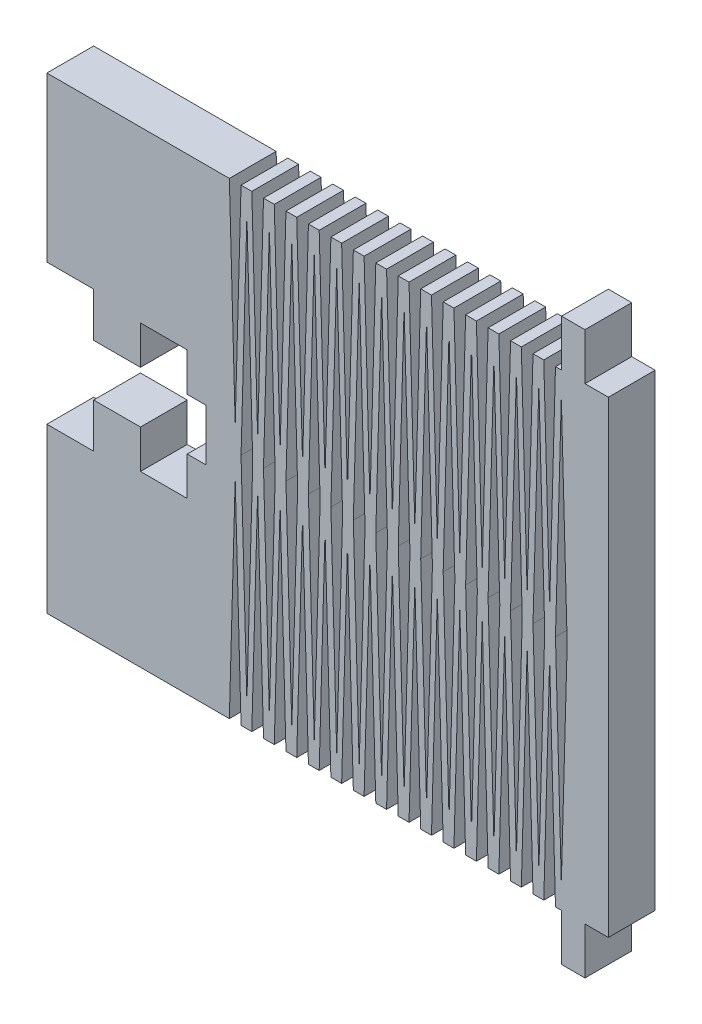
from build123d import *

# Parameters (mm, degrees)
BOSS_EXTRUDE2_DEPTH = 3.175


with BuildPart() as part:
    # Sketch1 → Boss-Extrude2 (new body)
    with BuildSketch(Plane.XY):
        Polygon((3.175, 20.6375), (3.175, 17.6276), (6.35, 17.6276), (6.35, 20.240625), (9.525, 20.240625), (9.525, 17.6276), (10.795, 17.6276), (10.795, 14.1224), (9.525, 14.1224), (9.525, 11.509375), (6.35, 11.509375), (6.35, 14.1224), (3.175, 14.1224), (3.175, 11.1125), (0, 11.1125), (0, 0), (12.3825, 0), (12.779375, 14.2875), (13.17625, 0), (13.9065, 0), (14.303375, 14.2875), (14.70025, 0), (15.4305, 0), (15.827375, 14.2875), (16.22425, 0), (16.9545, 0), (17.351375, 14.2875), (17.74825, 0), (18.4785, 0), (18.875375, 14.2875), (19.27225, 0), (20.0025, 0), (20.399375, 14.2875), (20.79625, 0), (21.5265, 0), (21.923375, 14.2875), (22.32025, 0), (23.0505, 0), (23.447375, 14.2875), (23.84425, 0), (24.5745, 0), (24.971375, 14.2875), (25.36825, 0), (26.0985, 0), (26.495375, 14.2875), (26.89225, 0), (27.6225, 0), (28.019375, 14.2875), (28.41625, 0), (29.1465, 0), (29.543375, 14.2875), (29.94025, 0), (30.6705, 0), (31.067375, 14.2875), (31.46425, 0), (32.1945, 0), (32.591375, 14.2875), (32.98825, 0), (33.7185, 0), (34.115375, 14.2875), (34.51225, 0), (34.925, 0), (34.925, -3.175), (36.5125, -3.175), (36.5125, 0), (38.1, 0), (38.1, 31.75), (36.5125, 31.75), (36.5125, 34.925), (34.925, 34.925), (34.925, 31.75), (34.51225, 31.75), (34.115375, 17.4625), (33.7185, 31.75), (32.98825, 31.75), (32.591375, 17.4625), (32.1945, 31.75), (31.46425, 31.75), (31.067375, 17.4625), (30.6705, 31.75), (29.94025, 31.75), (29.543375, 17.4625), (29.1465, 31.75), (28.41625, 31.75), (28.019375, 17.4625), (27.6225, 31.75), (26.89225, 31.75), (26.495375, 17.4625), (26.0985, 31.75), (25.36825, 31.75), (24.971375, 17.4625), (24.5745, 31.75), (23.84425, 31.75), (23.447375, 17.4625), (23.0505, 31.75), (22.32025, 31.75), (21.923375, 17.4625), (21.5265, 31.75), (20.79625, 31.75), (20.399375, 17.4625), (20.0025, 31.75), (19.27225, 31.75), (18.875375, 17.4625), (18.4785, 31.75), (17.74825, 31.75), (17.351375, 17.4625), (16.9545, 31.75), (16.22425, 31.75), (15.827375, 17.4625), (15.4305, 31.75), (14.70025, 31.75), (14.303375, 17.4625), (13.9065, 31.75), (13.17625, 31.75), (12.779375, 17.4625), (12.3825, 31.75), (0, 31.75), (0, 20.6375), align=None)
        Polygon((13.17625, 15.875), (13.573125, 30.1625), (13.97, 15.875), (13.573125, 1.5875), align=None, mode=Mode.SUBTRACT)
        Polygon((14.70025, 15.875), (15.097125, 30.1625), (15.494, 15.875), (15.097125, 1.5875), align=None, mode=Mode.SUBTRACT)
        Polygon((16.22425, 15.875), (16.621125, 30.1625), (17.018, 15.875), (16.621125, 1.5875), align=None, mode=Mode.SUBTRACT)
        Polygon((17.74825, 15.875), (18.145125, 30.1625), (18.542, 15.875), (18.145125, 1.5875), align=None, mode=Mode.SUBTRACT)
        Polygon((19.27225, 15.875), (19.669125, 30.1625), (20.066, 15.875), (19.669125, 1.5875), align=None, mode=Mode.SUBTRACT)
        Polygon((20.79625, 15.875), (21.193125, 30.1625), (21.59, 15.875), (21.193125, 1.5875), align=None, mode=Mode.SUBTRACT)
        Polygon((22.32025, 15.875), (22.717125, 30.1625), (23.114, 15.875), (22.717125, 1.5875), align=None, mode=Mode.SUBTRACT)
        Polygon((23.84425, 15.875), (24.241125, 30.1625), (24.638, 15.875), (24.241125, 1.5875), align=None, mode=Mode.SUBTRACT)
        Polygon((25.36825, 15.875), (25.765125, 30.1625), (26.162, 15.875), (25.765125, 1.5875), align=None, mode=Mode.SUBTRACT)
        Polygon((26.89225, 15.875), (27.289125, 30.1625), (27.686, 15.875), (27.289125, 1.5875), align=None, mode=Mode.SUBTRACT)
        Polygon((28.41625, 15.875), (28.813125, 30.1625), (29.21, 15.875), (28.813125, 1.5875), align=None, mode=Mode.SUBTRACT)
        Polygon((29.94025, 15.875), (30.337125, 30.1625), (30.734, 15.875), (30.337125, 1.5875), align=None, mode=Mode.SUBTRACT)
        Polygon((31.46425, 15.875), (31.861125, 30.1625), (32.258, 15.875), (31.861125, 1.5875), align=None, mode=Mode.SUBTRACT)
        Polygon((32.98825, 15.875), (33.385125, 30.1625), (33.782, 15.875), (33.385125, 1.5875), align=None, mode=Mode.SUBTRACT)
        Polygon((34.51225, 15.875), (34.909125, 30.1625), (35.306, 15.875), (34.909125, 1.5875), align=None, mode=Mode.SUBTRACT)
    extrude(amount=BOSS_EXTRUDE2_DEPTH)


solid = part.part
